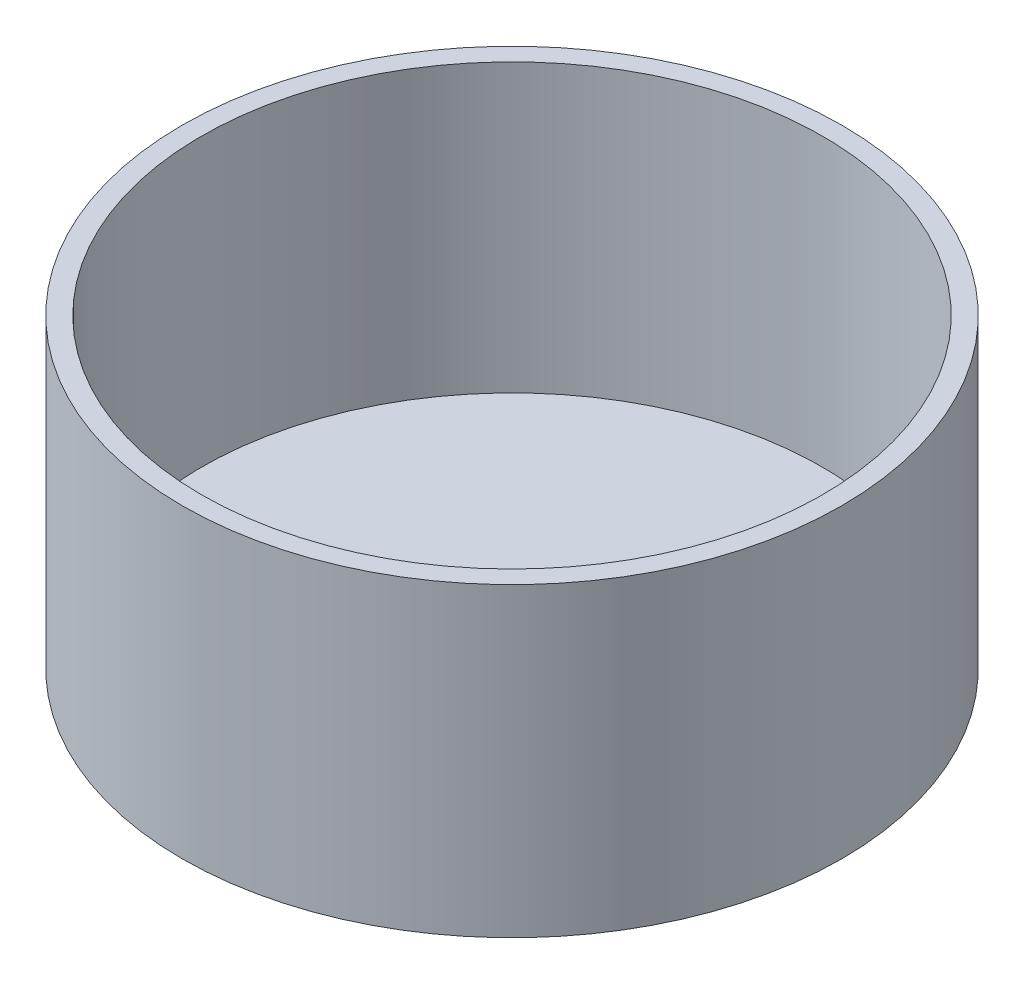
from build123d import *

# Parameters (mm, degrees)
CROQUIS1_R              = 32.5
SALIENTE_EXTRUIR1_DEPTH = 30
VACIADO1_T              = 2


with BuildPart() as part:
    # Croquis1 → Saliente-Extruir1 (new body)
    with BuildSketch(Plane(origin=(0, 0, 0), x_dir=(1, 0, 0), z_dir=(0, 1, 0))):
        with Locations(Location((0, 0, 0), (0, 0, 270))):
            Circle(CROQUIS1_R)
    extrude(amount=SALIENTE_EXTRUIR1_DEPTH)

    # Vaciado1
    vaciado1_openings = [part.faces().sort_by_distance(p)[0] for p in [
        (0, 30, 0),
    ]]
    offset(amount=VACIADO1_T, openings=vaciado1_openings, kind=Kind.INTERSECTION)


solid = part.part
